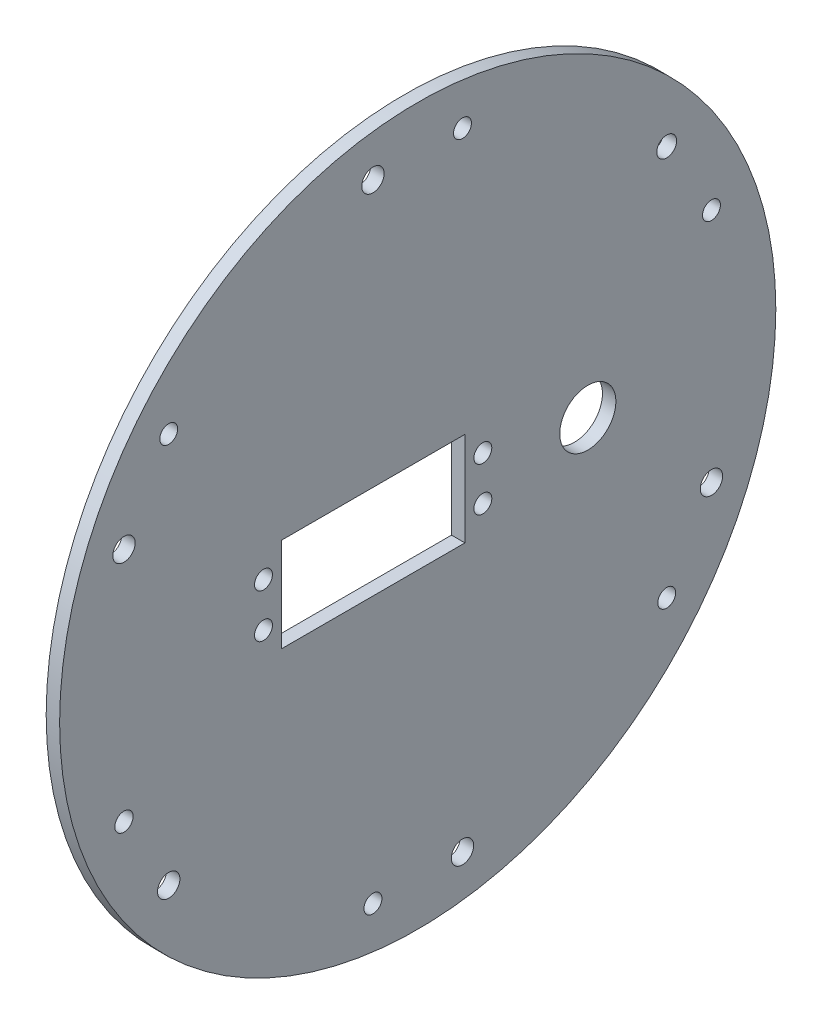
from build123d import *

# Parameters (mm, degrees)
SKETCH_1_R      = 80
SKETCH_1_R_2    = 6.269952148
SKETCH_1_R_3    = 2
SKETCH_1_R_4    = 2.5
SKETCH_1_R_5    = 2.214537903
SKETCH_1_R_6    = 2.039490197
SKETCH_1_W      = 41
SKETCH_1_H      = 21
EXTRUDE_1_DEPTH = 3


with BuildPart() as part:
    # ｽｹｯﾁ1 → ﾎﾞｽ - 押し出し1 (new body)
    with BuildSketch(Plane(origin=(0, 0, 0), x_dir=(0, 0, -1), z_dir=(1, 0, 0))):
        with Locations((-2426.873769578, 1479.495473195)):
            Circle(SKETCH_1_R)
        with Locations((-2388.873769578, 1479.495473195)):
            Circle(SKETCH_1_R_2, mode=Mode.SUBTRACT)
        with Locations((-2412.323769578, 1484.395473195)):
            Circle(SKETCH_1_R_3, mode=Mode.SUBTRACT)
        with Locations((-2412.323769578, 1474.595473195)):
            Circle(SKETCH_1_R_3, mode=Mode.SUBTRACT)
        with Locations((-2461.323769578, 1484.395473195)):
            Circle(SKETCH_1_R_3, mode=Mode.SUBTRACT)
        with Locations((-2461.323769578, 1474.595473195)):
            Circle(SKETCH_1_R_3, mode=Mode.SUBTRACT)
        with Locations((-2492.495547842, 1505.835219157)):
            Circle(SKETCH_1_R_4, mode=Mode.SUBTRACT)
        with Locations((-2482.495547842, 1523.155727232)):
            Circle(SKETCH_1_R_3, mode=Mode.SUBTRACT)
        with Locations((-2436.873769578, 1549.495473195)):
            Circle(SKETCH_1_R_4, mode=Mode.SUBTRACT)
        with Locations((-2416.873769578, 1549.495473195)):
            Circle(SKETCH_1_R_3, mode=Mode.SUBTRACT)
        with Locations((-2371.251991313, 1523.155727232)):
            Circle(SKETCH_1_R_5, mode=Mode.SUBTRACT)
        with Locations((-2361.251991313, 1505.835219157)):
            Circle(SKETCH_1_R_3, mode=Mode.SUBTRACT)
        with Locations((-2361.251991313, 1453.155727232)):
            Circle(SKETCH_1_R_4, mode=Mode.SUBTRACT)
        with Locations((-2371.251991313, 1435.835219157)):
            Circle(SKETCH_1_R_3, mode=Mode.SUBTRACT)
        with Locations((-2416.873769578, 1409.495473195)):
            Circle(SKETCH_1_R_4, mode=Mode.SUBTRACT)
        with Locations((-2436.873769578, 1409.495473195)):
            Circle(SKETCH_1_R_3, mode=Mode.SUBTRACT)
        with Locations((-2482.495547842, 1435.835219157)):
            Circle(SKETCH_1_R_4, mode=Mode.SUBTRACT)
        with Locations((-2492.495547842, 1453.155727232)):
            Circle(SKETCH_1_R_6, mode=Mode.SUBTRACT)
        with Locations((-2436.823769578, 1479.495473195)):
            Rectangle(SKETCH_1_W, SKETCH_1_H, mode=Mode.SUBTRACT)
    extrude(amount=EXTRUDE_1_DEPTH)


solid = part.part
